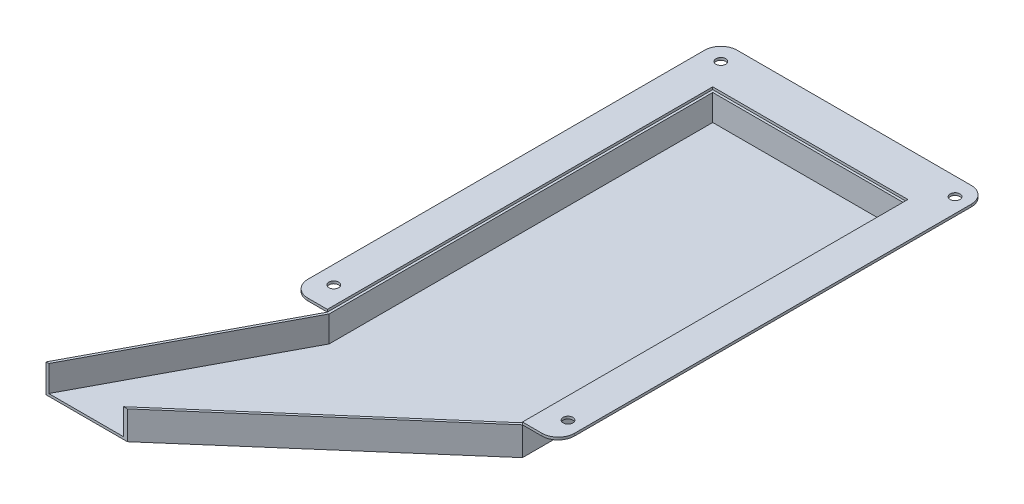
from build123d import *

# Parameters (mm, degrees)
BOSS_EXTRUDE1_DEPTH = 1.5
BOSS_EXTRUDE2_DEPTH = 16
SKETCH3_R           = 3
BOSS_EXTRUDE3_DEPTH = 1.5
FILLET1_R           = 10


with BuildPart() as part:
    # Sketch1 → Boss-Extrude1 (new body)
    with BuildSketch(Plane(origin=(0, 0, 0), x_dir=(1, 0, 0), z_dir=(0, 1, 0))):
        Polygon((0, 0), (0, 237), (120, 237), (120, 0), (-10, -113), (-60, -113), align=None)
    extrude(amount=BOSS_EXTRUDE1_DEPTH)

    # Sketch2 → Boss-Extrude2 (add)
    with BuildSketch(Plane(origin=(0, 1.5, 0), x_dir=(1, 0, 0), z_dir=(0, 1, 0))):
        Polygon((0, 237), (120, 237), (120, 0), (-10, -113), (-12.286463484, -113), (-10.560799767, -111.5), (118.5, 0.683618259), (118.5, 235.5), (1.5, 235.5), (1.5, -0.373534821), (-57.50520275, -111.5), (-58.301662927, -113), (-60, -113), (0, 0), align=None)
    extrude(amount=BOSS_EXTRUDE2_DEPTH)


with BuildPart() as body_2:
    # Sketch3 → Boss-Extrude3 (new body)
    with BuildSketch(Plane(origin=(0, 17.5, 0), x_dir=(1, 0, 0), z_dir=(0, 1, 0))):
        Polygon((-22, 264), (142, 264), (142, 0), (120, 0), (120, 237), (0, 237), (0, 0), (-22, 0), align=None)
        with Locations(Location((-11, 253, 0), (0, 0, 270))):
            Circle(SKETCH3_R, mode=Mode.SUBTRACT)
        with Locations(Location((133, 253, 0), (0, 0, 270))):
            Circle(SKETCH3_R, mode=Mode.SUBTRACT)
        with Locations(Location((-11, 15, 0), (0, 0, 270))):
            Circle(SKETCH3_R, mode=Mode.SUBTRACT)
        with Locations(Location((133, 15, 0), (0, 0, 270))):
            Circle(SKETCH3_R, mode=Mode.SUBTRACT)
    extrude(amount=BOSS_EXTRUDE3_DEPTH)

    # Fillet1
    fillet1_edges = [body_2.edges().sort_by_distance(p)[0] for p in [
        (-22, 18.25, -264),
        (142, 18.25, -264),
        (142, 18.25, 0),
        (-22, 18.25, 0),
    ]]
    fillet(fillet1_edges, radius=FILLET1_R)


solid = Compound([part.part, body_2.part])
